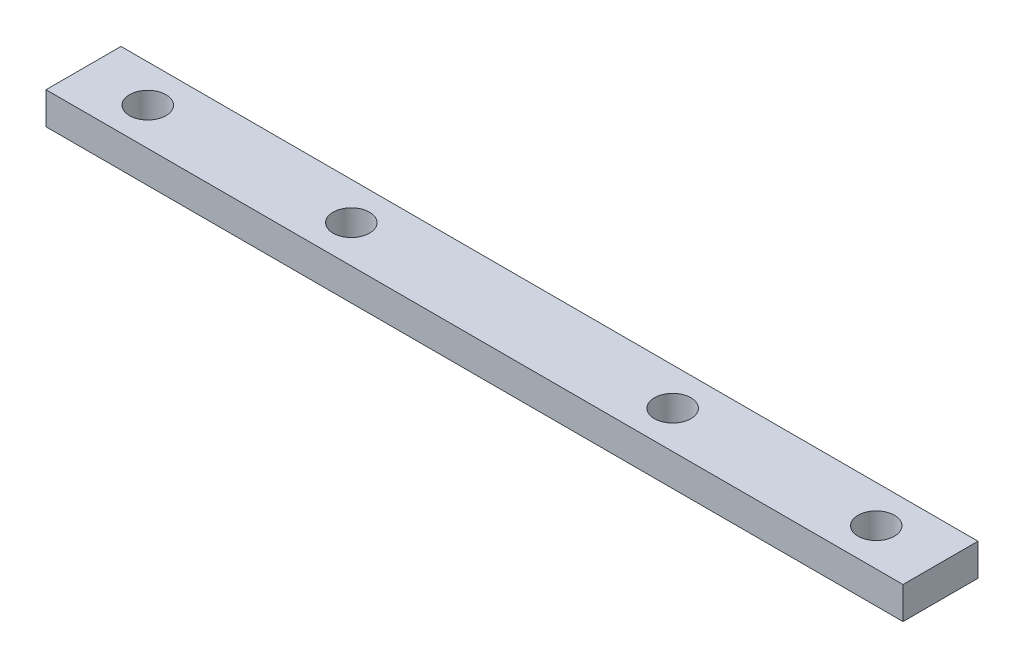
from build123d import *

# Parameters (mm, degrees)
SKETCH1_W           = 80
SKETCH1_H           = 7
BOSS_EXTRUDE1_DEPTH = 3
SKETCH2_R           = 1.7
CUT_EXTRUDE1_DEPTH  = 41.264748851


with BuildPart() as part:
    # Sketch1 → Boss-Extrude1 (new body)
    with BuildSketch(Plane(origin=(0, 0, 0), x_dir=(1, 0, 0), z_dir=(0, 1, 0))):
        Rectangle(SKETCH1_W, SKETCH1_H)
    extrude(amount=BOSS_EXTRUDE1_DEPTH)

    # Sketch2 → Cut-Extrude1 (cut, through all)
    with BuildSketch(Plane(origin=(0, 3, 0), x_dir=(1, 0, 0), z_dir=(0, 1, 0))):
        with Locations(Location((-34, 0, 0), (0, 0, 270))):
            Circle(SKETCH2_R)
        with Locations(Location((-15, 0, 0), (0, 0, 270))):
            Circle(SKETCH2_R)
        with Locations(Location((15, 0, 0), (0, 0, 270))):
            Circle(SKETCH2_R)
        with Locations(Location((34, 0, 0), (0, 0, 270))):
            Circle(SKETCH2_R)
    extrude(amount=-CUT_EXTRUDE1_DEPTH, mode=Mode.SUBTRACT)


solid = part.part
